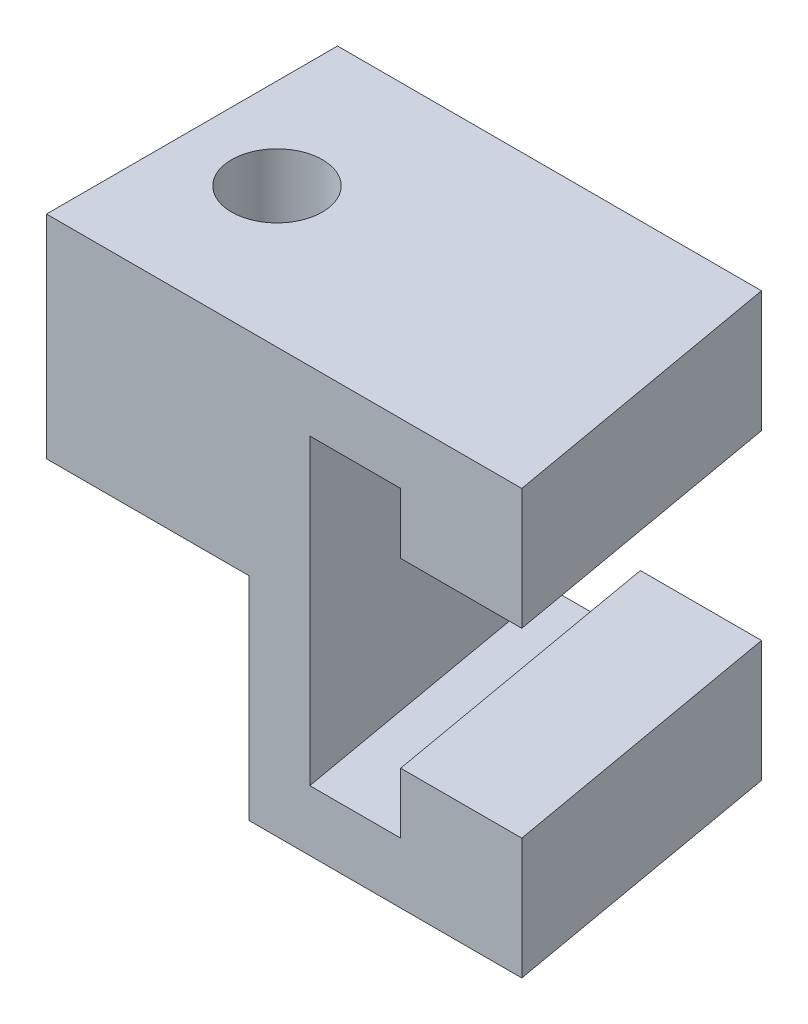
from build123d import *

# Parameters (mm, degrees)
SKETCH4_W           = 35
SKETCH4_H           = 35
BOSS_EXTRUDE2_DEPTH = 48.050661441
SKETCH5_R           = 7.5
CUT_EXTRUDE1_DEPTH  = 44


with BuildPart() as part:
    # Sweep1: sweep along a path in Sketch3
    with BuildLine(Plane(origin=(0, 0, 0), x_dir=(1, 0, 0), z_dir=(0, 1, 0))) as sweep1_path:
        Line((55.06330006, -48.050661441), (46.590672007, 0))
    # Sketch1<2> → Sweep1 (sweep)
    with BuildSketch(Plane.XY):
        Polygon((0, 25), (0, -25), (15, -25), (15, -15), (35, -15), (35, -35), (-10, -35), (-10, 35), (35, 35), (35, 15), (15, 15), (15, 25), align=None)
    sweep(path=sweep1_path.line)

    # Sketch4 → Boss-Extrude2 (add)
    with BuildSketch(Plane.XY):
        with Locations((-17.5, 17.5)):
            Rectangle(SKETCH4_W, SKETCH4_H)
    extrude(amount=BOSS_EXTRUDE2_DEPTH)

    # Sketch5 → Cut-Extrude1 (cut)
    with BuildSketch(Plane(origin=(0, 35, 0), x_dir=(1, 0, 0), z_dir=(0, 1, 0))):
        with Locations(Location((-20, -25, 0), (0, 0, 270))):
            Circle(SKETCH5_R)
    extrude(amount=-CUT_EXTRUDE1_DEPTH, mode=Mode.SUBTRACT)


solid = part.part
